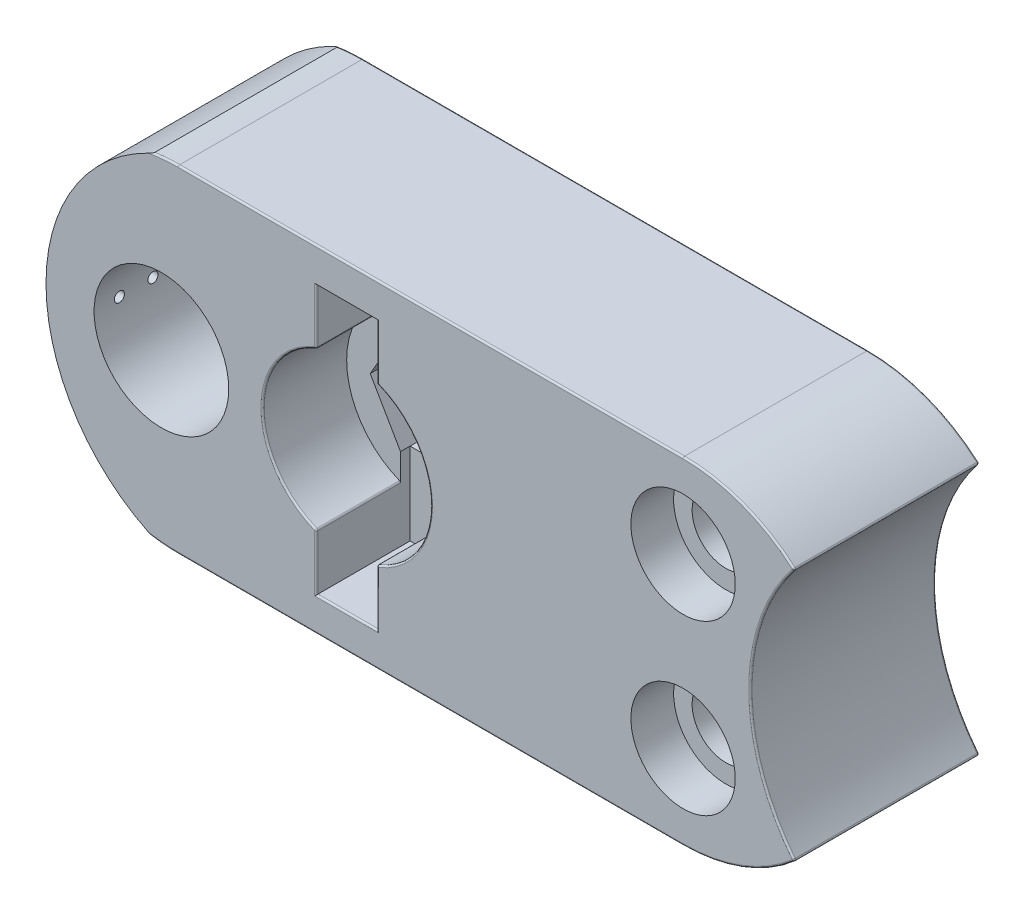
from build123d import *

# Parameters (mm, degrees)
SKETCH_1_R                                   = 40
EXTRUDE_1_DEPTH                              = 110
SKETCH_2_R                                   = 3
CUT_EXTRUDE_2_DEPTH                          = 150
SKETCH_3_R                                   = 50
CUT_EXTRUDE_3_DEPTH                          = 50
CUT_EXTRUDE_4_DEPTH                          = 10
SKETCH_5_W                                   = 36
SKETCH_5_H                                   = 160
CUT_EXTRUDE_7_DEPTH                          = 122
CUT_EXTRUDE_8_DEPTH                          = 10
SKETCH_7_R                                   = 3
CUT_EXTRUDE_9_DEPTH                          = 10
CUT_EXTRUDE_12_DEPTH                         = 200
SKETCH_9_R                                   = 31
SKETCH_9_R_2                                 = 12.5
CUT_EXTRUDE_13_DEPTH                         = 25.4
MIRROR_3_AT_THE_SECOND_PLANE_COPY_1_DEPTH    = 200
MIRROR_3_AT_THE_SECOND_PLANE_COPY_2_SKET_R   = 31
MIRROR_3_AT_THE_SECOND_PLANE_COPY_2_SKET_R_2 = 12.5
MIRROR_3_AT_THE_SECOND_PLANE_COPY_2_DEPTH    = 25.4
EXTRUDE_START                                = 4.3
EXTRUDE_2_DEPTH                              = 4.3
SKETCH_11_W                                  = 36
SKETCH_11_H                                  = 48.823085464
SKETCH_11_R                                  = 3
EXTRUDE_3_DEPTH                              = 4.3
CUT_EXTRUDE_START                            = -200
CUT_EXTRUDE_14_DEPTH                         = 200
SKETCH_13_R                                  = 20
CUT_EXTRUDE_15_DEPTH                         = 200
CUT_EXTRUDE_16_DEPTH                         = 200
FILLET_1_R                                   = 1
FILLET_2_R                                   = 1


with BuildPart() as part:
    # 草图1 → 凸台-拉伸1 (new body)
    with BuildSketch(Plane.XY):
        with BuildLine():
            Line((-100.092421442, 100), (199.907578558, 100))
            ThreePointArc((199.907578558, 100), (299.907578558, 0), (199.907578558, -100))
            Line((199.907578558, -100), (-100.092421442, -100))
            ThreePointArc((-100.092421442, -100), (-200.092421442, 0), (-100.092421442, 100))
        make_face()
        with Locations((-110.092421442, 0)):
            Circle(SKETCH_1_R, mode=Mode.SUBTRACT)
    extrude(amount=EXTRUDE_1_DEPTH)

    # 草图2 → 切除-拉伸2 (cut)
    with BuildSketch(Plane(origin=(-100, 0, 0), x_dir=(0, 0, -1), z_dir=(1, 0, 0))):
        with Locations((-95, 0)):
            Circle(SKETCH_2_R)
        with Locations((-75, 0)):
            Circle(SKETCH_2_R)
        with Locations((-55, 0)):
            Circle(SKETCH_2_R)
    extrude(amount=-CUT_EXTRUDE_2_DEPTH, mode=Mode.SUBTRACT)

    # 草图3 → 切除-拉伸3 (cut)
    with BuildSketch(Plane.XY.offset(110)):
        Circle(SKETCH_3_R)
    extrude(amount=-CUT_EXTRUDE_3_DEPTH, mode=Mode.SUBTRACT)

    # 草图4 → 切除-拉伸4 (cut)
    with BuildSketch(Plane.XY.offset(60)):
        Polygon((36, 0), (18, 31.176914536), (-18, 31.176914536), (-36, 0), (-18, -31.176914536), (18, -31.176914536), align=None)
    extrude(amount=-CUT_EXTRUDE_4_DEPTH, mode=Mode.SUBTRACT)

    # 草图5 → 切除-拉伸7 (cut)
    with BuildSketch(Plane.XY.offset(50)):
        Rectangle(SKETCH_5_W, SKETCH_5_H)
    extrude(amount=CUT_EXTRUDE_7_DEPTH, mode=Mode.SUBTRACT)

    # 草图6 → 切除-拉伸8 (cut)
    with BuildSketch(Plane.XY.offset(50)):
        Polygon((36, 0), (18, 31.176914536), (-18, 31.176914536), (-36, 0), (-18, -31.176914536), (18, -31.176914536), align=None)
    extrude(amount=-CUT_EXTRUDE_8_DEPTH, mode=Mode.SUBTRACT)

    # 草图7 → 切除-拉伸9 (cut)
    with BuildSketch(Plane.XY.offset(50)):
        with Locations((0, 62)):
            Circle(SKETCH_7_R)
    cut_extrude_9 = extrude(amount=-CUT_EXTRUDE_9_DEPTH, mode=Mode.SUBTRACT)

    # 镜向1: 切除-拉伸9 across plane
    add(cut_extrude_9.mirror(Plane.ZX), mode=Mode.SUBTRACT)

    # 草图8 → 切除-拉伸12 (cut)
    with BuildSketch(Plane.XY.offset(110)):
        with BuildLine():
            ThreePointArc((212.407578558, 50), (208.746413323, 58.838834765), (199.907578558, 62.5))
            Line((199.907578558, 62.5), (199.907578558, 37.5))
            ThreePointArc((199.907578558, 37.5), (208.746413323, 41.161165235), (212.407578558, 50))
        make_face()
        with BuildLine():
            Line((199.907578558, 37.5), (199.907578558, 62.5))
            ThreePointArc((199.907578558, 62.5), (187.407578558, 50), (199.907578558, 37.5))
        make_face()
    cut_extrude_12 = extrude(amount=-CUT_EXTRUDE_12_DEPTH, mode=Mode.SUBTRACT)

    # 草图9 → 切除-拉伸13 (cut)
    with BuildSketch(Plane.XY.offset(110)):
        with Locations((199.907578558, 50)):
            Circle(SKETCH_9_R)
        with Locations((199.907578558, 50)):
            Circle(SKETCH_9_R_2, mode=Mode.SUBTRACT)
    cut_extrude_13 = extrude(amount=-CUT_EXTRUDE_13_DEPTH, mode=Mode.SUBTRACT)

    # 镜向3: 切除-拉伸12, 切除-拉伸13 across plane
    add(cut_extrude_12.mirror(Plane.ZX), mode=Mode.SUBTRACT)
    add(cut_extrude_13.mirror(Plane.ZX), mode=Mode.SUBTRACT)

    # 镜向3 at the second plane: 切除-拉伸12, 切除-拉伸13 across plane
    add(cut_extrude_12.mirror(Plane.XY.offset(55)), mode=Mode.SUBTRACT)
    add(cut_extrude_13.mirror(Plane.XY.offset(55)), mode=Mode.SUBTRACT)

    # 镜向3 at the second plane copy 1 sket → 镜向3 at the second plane copy 1 (cut)
    with BuildSketch(Plane(origin=(0, 0, 0), x_dir=(1, 0, 0), z_dir=(0, 0, -1))):
        with BuildLine():
            ThreePointArc((212.407578558, 50), (208.746413323, 58.838834765), (199.907578558, 62.5))
            Line((199.907578558, 62.5), (199.907578558, 37.5))
            ThreePointArc((199.907578558, 37.5), (208.746413323, 41.161165235), (212.407578558, 50))
        make_face()
        with BuildLine():
            Line((199.907578558, 37.5), (199.907578558, 62.5))
            ThreePointArc((199.907578558, 62.5), (187.407578558, 50), (199.907578558, 37.5))
        make_face()
    extrude(amount=-MIRROR_3_AT_THE_SECOND_PLANE_COPY_1_DEPTH, mode=Mode.SUBTRACT)

    # 镜向3 at the second plane copy 2 sket → 镜向3 at the second plane copy 2 (cut)
    with BuildSketch(Plane(origin=(0, 0, 0), x_dir=(1, 0, 0), z_dir=(0, 0, -1))):
        with Locations((199.907578558, 50)):
            Circle(MIRROR_3_AT_THE_SECOND_PLANE_COPY_2_SKET_R)
        with Locations((199.907578558, 50)):
            Circle(MIRROR_3_AT_THE_SECOND_PLANE_COPY_2_SKET_R_2, mode=Mode.SUBTRACT)
    extrude(amount=-MIRROR_3_AT_THE_SECOND_PLANE_COPY_2_DEPTH, mode=Mode.SUBTRACT)

    # 草图10 → 凸台-拉伸2 (add)
    with BuildSketch(Plane.XY.offset(40).offset(EXTRUDE_START)):
        with BuildLine():
            ThreePointArc((18, 31.176914536), (31.176914536, 18), (36, 0))
            ThreePointArc((36, 0), (31.176914536, -18), (18, -31.176914536))
            Line((18, -31.176914536), (18, -46.647615159))
            ThreePointArc((18, -46.647615159), (41.231056256, -28.284271247), (50, 0))
            ThreePointArc((50, 0), (41.231056256, 28.284271247), (18, 46.647615159))
            Line((18, 46.647615159), (18, 31.176914536))
        make_face()
        with BuildLine():
            ThreePointArc((-36, 0), (-31.176914536, 18), (-18, 31.176914536))
            Line((-18, 31.176914536), (-18, 46.647615159))
            ThreePointArc((-18, 46.647615159), (-50, 0), (-18, -46.647615159))
            Line((-18, -46.647615159), (-18, -31.176914536))
            ThreePointArc((-18, -31.176914536), (-31.176914536, -18), (-36, 0))
        make_face()
        with BuildLine():
            Line((18, 31.176914536), (36, 0))
            ThreePointArc((36, 0), (31.176914536, 18), (18, 31.176914536))
        make_face()
        with BuildLine():
            ThreePointArc((18, -31.176914536), (31.176914536, -18), (36, 0))
            Line((36, 0), (18, -31.176914536))
        make_face()
        with BuildLine():
            ThreePointArc((-36, 0), (-31.176914536, -18), (-18, -31.176914536))
            Line((-18, -31.176914536), (-36, 0))
        make_face()
        with BuildLine():
            Line((-36, 0), (-18, 31.176914536))
            ThreePointArc((-18, 31.176914536), (-31.176914536, 18), (-36, 0))
        make_face()
    extrude(amount=-EXTRUDE_2_DEPTH)

    # 草图11 → 凸台-拉伸3 (add)
    with BuildSketch(Plane.XY.offset(50).offset(EXTRUDE_START)):
        with Locations((0, 55.588457268)):
            Rectangle(SKETCH_11_W, SKETCH_11_H)
        with Locations((0, 62)):
            Circle(SKETCH_11_R, mode=Mode.SUBTRACT)
    extrude_3 = extrude(amount=-EXTRUDE_3_DEPTH)

    # 镜向4: 凸台-拉伸3 across plane
    add(extrude_3.mirror(Plane.ZX))

    # 草图12 → 切除-拉伸14 (cut)
    with BuildSketch(Plane.XY.offset(110).offset(CUT_EXTRUDE_START)):
        with BuildLine():
            ThreePointArc((299.907578558, 0), (291.080491202, 41.079191813), (266.157578558, 74.906191333))
            ThreePointArc((266.157578558, 74.906191333), (246.660062029, 39.686269666), (239.907578558, 0))
            Line((239.907578558, 0), (299.907578558, 0))
        make_face()
        with BuildLine():
            ThreePointArc((479.907578558, 0), (399.593848224, 113.247516529), (266.157578558, 74.906191333))
            ThreePointArc((266.157578558, 74.906191333), (291.080491202, 41.079191813), (299.907578558, 0))
            ThreePointArc((299.907578558, 0), (291.080491202, -41.079191813), (266.157578558, -74.906191333))
            ThreePointArc((266.157578558, -74.906191333), (399.593848224, -113.247516529), (479.907578558, 0))
        make_face()
        with BuildLine():
            Line((299.907578558, 0), (239.907578558, 0))
            ThreePointArc((239.907578558, 0), (246.660062029, -39.686269666), (266.157578558, -74.906191333))
            ThreePointArc((266.157578558, -74.906191333), (291.080491202, -41.079191813), (299.907578558, 0))
        make_face()
    extrude(amount=CUT_EXTRUDE_14_DEPTH, mode=Mode.SUBTRACT)

    # 草图13 → 切除-拉伸15 (cut)
    with BuildSketch(Plane.XY.offset(84.6)):
        with Locations((199.907578558, 50)):
            Circle(SKETCH_13_R)
    cut_extrude_15 = extrude(amount=-CUT_EXTRUDE_15_DEPTH, mode=Mode.SUBTRACT)

    # 镜向5: 切除-拉伸15 across plane
    add(cut_extrude_15.mirror(Plane.ZX), mode=Mode.SUBTRACT)

    # 草图14 → 切除-拉伸16 (cut)
    with BuildSketch(Plane.XY.offset(110).offset(CUT_EXTRUDE_START)):
        with BuildLine():
            ThreePointArc((-114.938685096, -98.891801761), (-178.67776032, 0), (-114.938685096, 98.891801761))
            ThreePointArc((-114.938685096, 98.891801761), (-200.092421442, 0), (-114.938685096, -98.891801761))
        make_face()
    extrude(amount=CUT_EXTRUDE_16_DEPTH, mode=Mode.SUBTRACT)

    # 圆角1
    fillet_1_edges = [part.edges().sort_by_distance(p)[0] for p in [
        (235.329188253, -93.516359888, 110),
        (49.907578558, 100, 110),
        (235.329188253, 93.516359888, 0),
        (235.329188253, 93.516359888, 110),
        (266.157578558, 74.906191333, 55),
        (266.157578558, -74.906191333, 55),
        (239.907578558, 0, 0),
        (239.907578558, 0, 110),
        (-107.536204885, -99.722565591, 0),
        (-107.536204885, -99.722565591, 110),
        (-107.536204885, 99.722565591, 110),
        (49.907578558, 100, 0),
        (235.329188253, -93.516359888, 0),
        (49.907578558, -100, 0),
        (-107.536204885, 99.722565591, 0),
        (49.907578558, -100, 110),
    ]]
    fillet(fillet_1_edges, radius=FILLET_1_R)

    # 圆角2
    fillet_2_edges = [part.edges().sort_by_distance(p)[0] for p in [
        (-50, 0, 110),
        (50, 0, 110),
        (0, -80, 110),
        (-18, 46.647615159, 85),
        (-18, -46.647615159, 85),
        (-18, -63.323807579, 110),
        (18, -46.647615159, 85),
        (18, 46.647615159, 85),
        (18, -63.323807579, 110),
        (-18, 63.323807579, 110),
        (18, 63.323807579, 110),
    ]]
    fillet(fillet_2_edges, radius=FILLET_2_R)


solid = part.part
